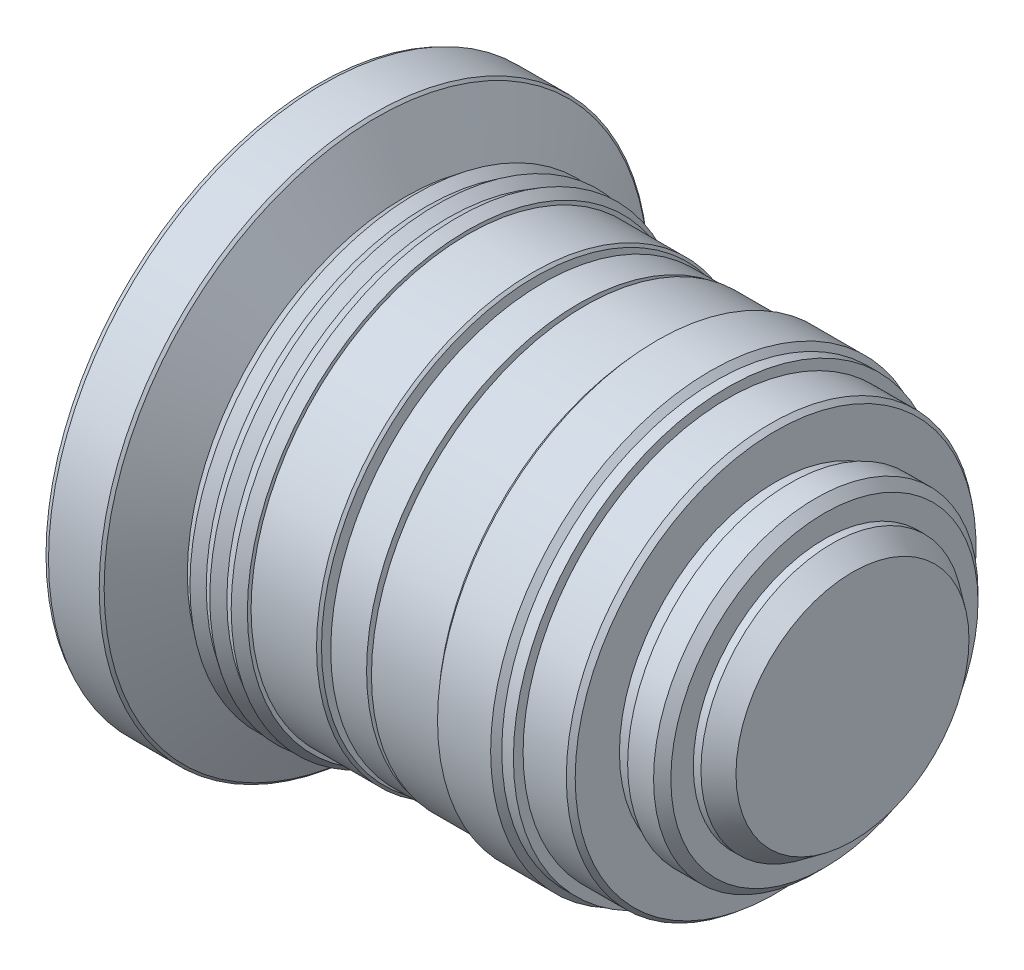
from build123d import *


with BuildPart() as part:
    # Model → Повернуть1 (revolve)
    with BuildSketch(Plane.XY, mode=Mode.PRIVATE) as revolve_1_sk:
        Polygon((0, 0), (0, -22.297439151), (0.406986693, -22.5), (4.563171418, -22.5), (4.765560012, -22.297439151), (7.132579794, -17.847080181), (8.034078204, -18.53333859), (8.879510019, -18.045513069), (9.72476958, -18.601092135), (10.570023757, -18.045513069), (11.410266397, -18.530582514), (12.250724355, -18.045513069), (12.250724355, -17.741666414), (17.616266787, -17.741666414), (17.818865316, -17.539062501), (17.818865316, -16.425629172), (18.426031098, -16.425629172), (18.426031098, -17.387144556), (21.362129874, -17.387144556), (21.362129874, -16.425629172), (21.868225167, -16.425629172), (21.868225167, -17.493893941), (27.334902683, -17.493893941), (27.790688815, -18), (32.143900705, -18), (32.599331562, -17.544536845), (33.552402733, -17.544536845), (33.552338057, -16.75), (37.095113357, -16.75), (37.5, -16.425629172), (37.5, -12.801691559), (38.665364669, -12.801691559), (38.665364669, -13.294307916), (40.791343859, -13.294307916), (41.5, -12.586706835), (41.5, -10.75), (42.129406807, -10.75), (43.8, -9.548466361), (43.8, 0), align=None)
    revolve(revolve_1_sk.sketch.rotate(Axis((0, 0, 0), (1, 0, 0)), 270), axis=Axis((0, 0, 0), (1, 0, 0)))


solid = part.part
